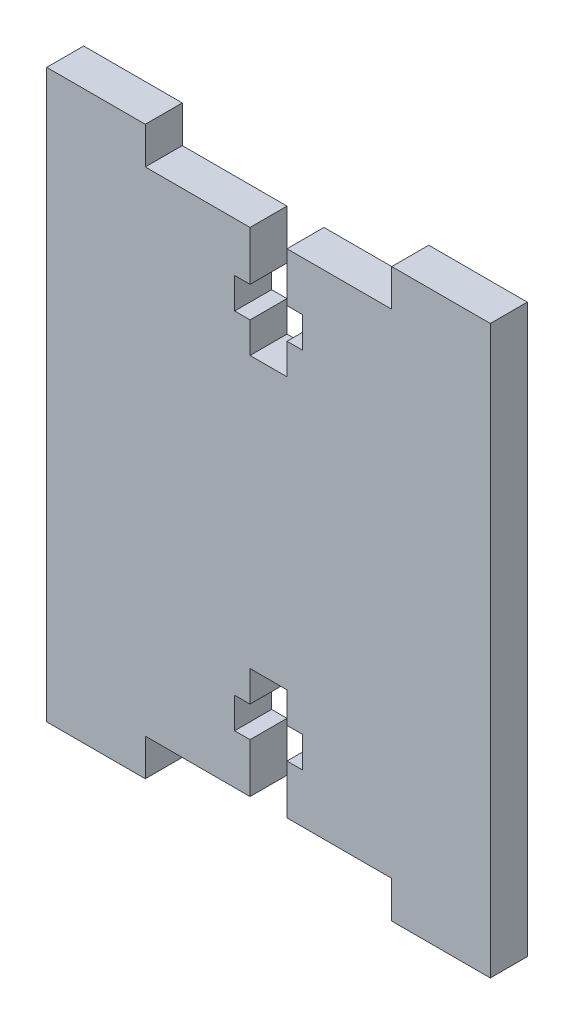
from build123d import *

# Parameters (mm, degrees)
RESSALTO_EXTRUS_O1_DEPTH = 3


with BuildPart() as part:
    # Esboço1 → Ressalto-extrusão1 (new body)
    with BuildSketch(Plane.XY):
        Polygon((2.25, 0), (-6.25, 0), (-6.25, 2), (-6.25, 3), (-14.25, 3), (-14.25, 2), (-14.25, -42), (-14.25, -43), (-6.25, -43), (-6.25, -42), (-6.25, -40), (2.25, -40), (2.25, -36), (1, -36), (1, -33.5), (2.25, -33.5), (2.25, -31), (5.25, -31), (5.25, -33.5), (6.5, -33.5), (6.5, -36), (5.25, -36), (5.25, -40), (13.75, -40), (13.75, -42), (13.75, -43), (21.75, -43), (21.75, -42), (21.75, 2), (21.75, 3), (13.75, 3), (13.75, 2), (13.75, 0), (5.25, 0), (5.25, -4), (6.5, -4), (6.5, -6.5), (5.25, -6.5), (5.25, -9), (2.25, -9), (2.25, -6.5), (1, -6.5), (1, -4), (2.25, -4), align=None)
    extrude(amount=RESSALTO_EXTRUS_O1_DEPTH)


solid = part.part
